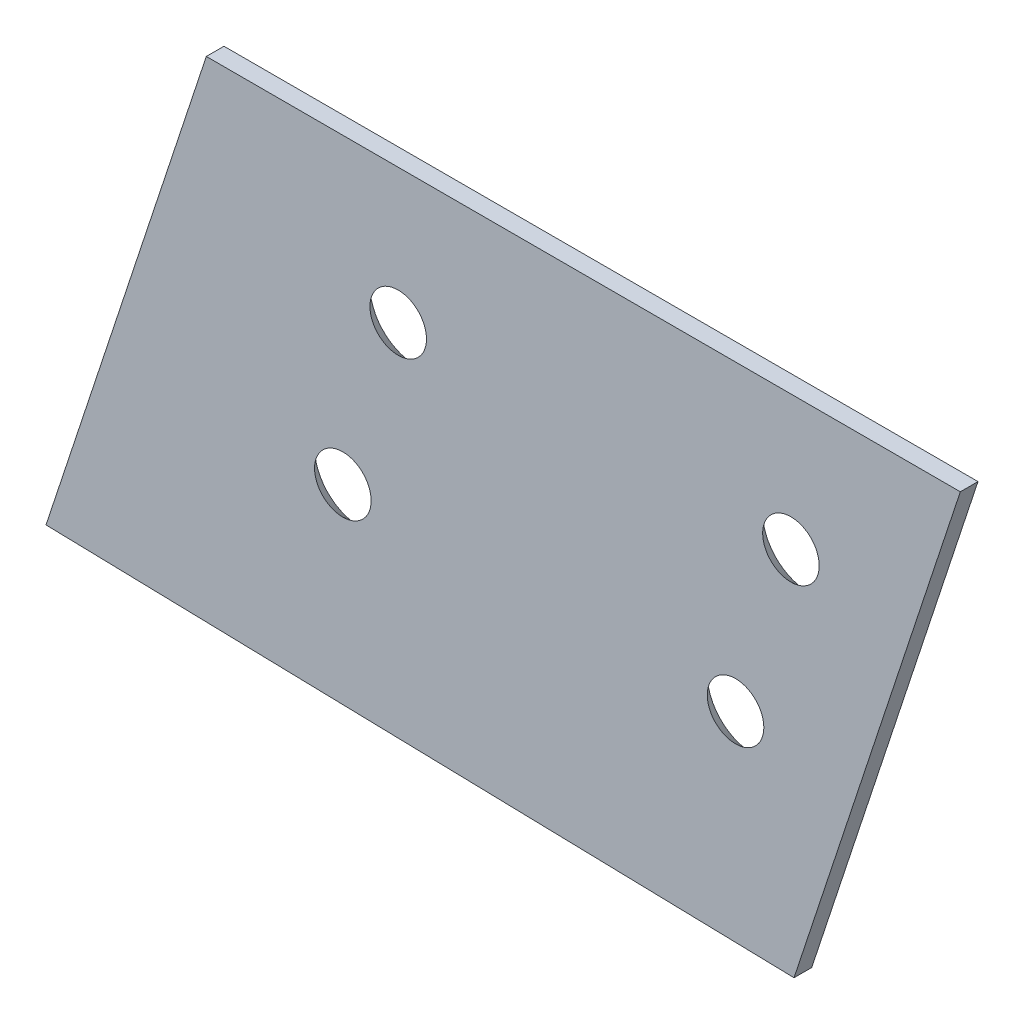
from build123d import *

# Parameters (mm, degrees)
BOSS_EXTRUDE1_DEPTH                            = 2
BOSS_EXTRUDE2_DEPTH                            = 2
SKETCH4_R                                      = 2.5
CUT_EXTRUDE2_DEPTH                             = 2
CSK_FOR_M5_FLAT_HEAD_MACHINE_SCREW1_AT_2_COUNT = 2
CSK_FOR_M5_FLAT_HEAD_MACHINE_SCREW1_AT_2_PITCH = 44.45
CSK_FOR_M5_FLAT_HEAD_MACHINE_SCREW1_AT_3_COUNT = 2
CSK_FOR_M5_FLAT_HEAD_MACHINE_SCREW1_AT_3_PITCH = 54.156278026
CSK_FOR_M5_FLAT_HEAD_MACHINE_SCREW1_AT_4_COUNT = 2
CSK_FOR_M5_FLAT_HEAD_MACHINE_SCREW1_AT_4_PITCH = 20


with BuildPart() as part:
    # Sketch2 → Boss-Extrude1 (new body)
    with BuildSketch(Plane.XY):
        Polygon((-54.61917065, -24.589230235), (30.72482935, -24.589230235), (13.852659447, -75.725684813), (-71.491340553, -75.725684813), align=None)
    extrude(amount=BOSS_EXTRUDE1_DEPTH)

    # Sketch3 → Boss-Extrude2 (add)
    with BuildSketch(Plane.XY.offset(2)):
        Polygon((-72.764711867, -79.585039875), (11.90144755, -81.639450446), (13.852659447, -75.725684813), (-71.491340553, -75.725684813), align=None)
    extrude(amount=-BOSS_EXTRUDE2_DEPTH)

    # Sketch4 → Cut-Extrude2 (cut)
    with BuildSketch(Plane.XY.offset(2)):
        with Locations((-32.900665919, -39.829230235)):
            Circle(SKETCH4_R)
        with Locations((11.549334081, -39.829230235)):
            Circle(SKETCH4_R)
        with Locations((5.282742972, -58.822119322)):
            Circle(SKETCH4_R)
        with Locations((-39.167257028, -58.822119322)):
            Circle(SKETCH4_R)
    extrude(amount=-CUT_EXTRUDE2_DEPTH, mode=Mode.SUBTRACT)

    # Sketch5 → CSK for M5 Flat Head Machine Screw1 (revolve, cut)
    with BuildSketch(Plane(origin=(11.549334081, -39.829230235, 0), x_dir=(0, 1, 0), z_dir=(1, 0, 0))):
        Polygon((0, 0), (0, 2), (2.75, 2), (2.75, 2.45), (5.2, 0), align=None)
    csk_for_m5_flat_head_machine_screw1 = revolve(axis=Axis((11.549334081, -39.829230235, -6.35), (0, 0, 1)), mode=Mode.SUBTRACT)

    # CSK for M5 Flat Head Machine Screw1 at 2: CSK for M5 Flat Head Machine Screw1 ×2
    with Locations(*[(-i * CSK_FOR_M5_FLAT_HEAD_MACHINE_SCREW1_AT_2_PITCH, 0, 0) for i in range(1, CSK_FOR_M5_FLAT_HEAD_MACHINE_SCREW1_AT_2_COUNT)]):
        add(csk_for_m5_flat_head_machine_screw1, mode=Mode.SUBTRACT)

    # CSK for M5 Flat Head Machine Screw1 at 3: CSK for M5 Flat Head Machine Screw1 ×2
    with Locations(*[Vector(-0.9364859063085671, -0.35070521422616713, 0) * (i * CSK_FOR_M5_FLAT_HEAD_MACHINE_SCREW1_AT_3_PITCH) for i in range(1, CSK_FOR_M5_FLAT_HEAD_MACHINE_SCREW1_AT_3_COUNT)]):
        add(csk_for_m5_flat_head_machine_screw1, mode=Mode.SUBTRACT)

    # CSK for M5 Flat Head Machine Screw1 at 4: CSK for M5 Flat Head Machine Screw1 ×2
    with Locations(*[Vector(-0.31332955547970937, -0.9496444543421964, 0) * (i * CSK_FOR_M5_FLAT_HEAD_MACHINE_SCREW1_AT_4_PITCH) for i in range(1, CSK_FOR_M5_FLAT_HEAD_MACHINE_SCREW1_AT_4_COUNT)]):
        add(csk_for_m5_flat_head_machine_screw1, mode=Mode.SUBTRACT)


solid = part.part
